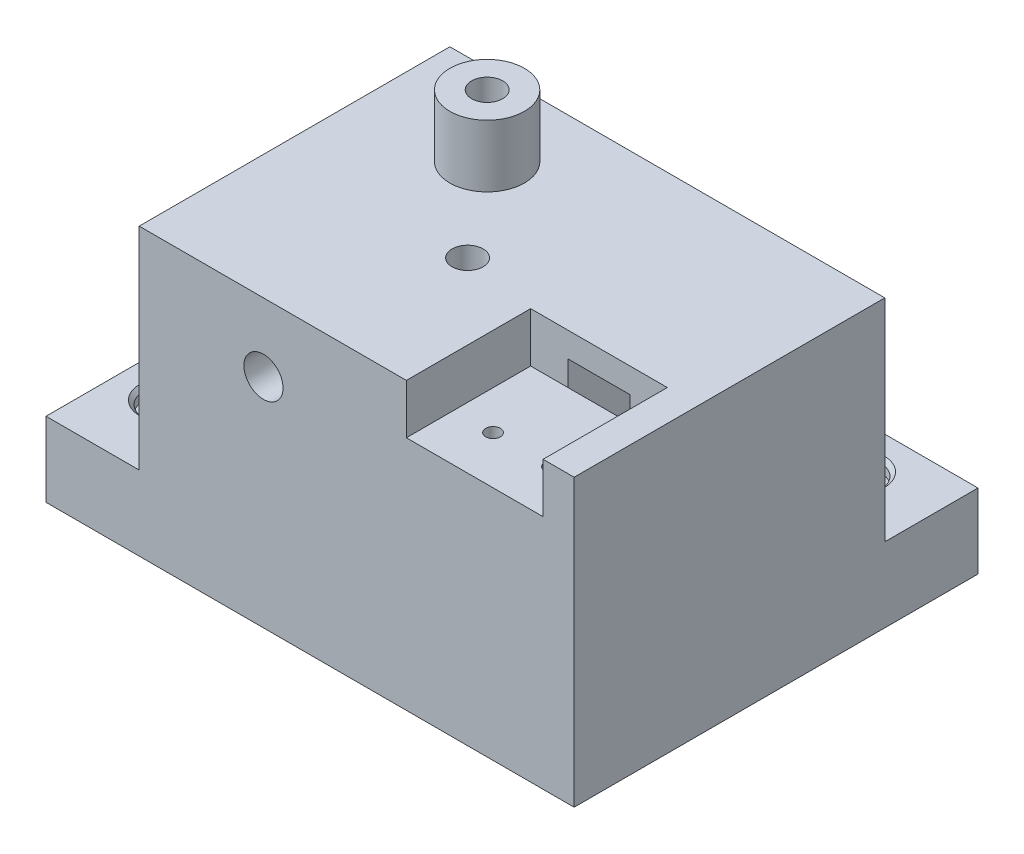
from build123d import *

# Parameters (mm, degrees)
SKETCH1_W                                   = 70
SKETCH1_H                                   = 50
BOSS_EXTRUDE1_DEPTH                         = 46
SKETCH2_R                                   = 3.15
CUT_EXTRUDE1_DEPTH                          = 10
SKETCH3_R                                   = 3.15
CUT_EXTRUDE2_DEPTH                          = 30
SKETCH4_R                                   = 2.5
CUT_EXTRUDE3_DEPTH                          = 10
SKETCH5_W                                   = 50
SKETCH5_H                                   = 12
BOSS_EXTRUDE2_DEPTH                         = 15
SKETCH8_W                                   = 85
SKETCH8_H                                   = 12
BOSS_EXTRUDE5_DEPTH                         = 15
CBORE_FOR_5_BINDING_HEAD_MACHINE_SC_2_COUNT = 2
CBORE_FOR_5_BINDING_HEAD_MACHINE_SC_2_PITCH = 45.5
CBORE_FOR_5_BINDING_HEAD_MACHINE_SC_3_COUNT = 2
CBORE_FOR_5_BINDING_HEAD_MACHINE_SC_3_PITCH = 79.7527429
SKETCH12_R                                  = 3.15
BOSS_EXTRUDE6_DEPTH                         = 10
BOSS_EXTRUDE7_START                         = 10
SKETCH13_R                                  = 6
SKETCH13_R_2                                = 2.5
BOSS_EXTRUDE7_DEPTH                         = 10
SKETCH14_W                                  = 22
SKETCH14_H                                  = 8
CUT_EXTRUDE4_DEPTH                          = 20
SKETCH15_R                                  = 1.185
CUT_EXTRUDE5_DEPTH                          = 10
CUT_EXTRUDE6_DEPTH                          = 10
SKETCH17_W                                  = 10
SKETCH17_H                                  = 10
CUT_EXTRUDE7_DEPTH                          = 63
CUT_EXTRUDE8_DEPTH                          = 2


with BuildPart() as part:
    # Sketch1 → Boss-Extrude1 (new body)
    with BuildSketch(Plane(origin=(0, 0, 0), x_dir=(1, 0, 0), z_dir=(0, 1, 0))):
        with Locations((35, -25)):
            Rectangle(SKETCH1_W, SKETCH1_H)
    extrude(amount=BOSS_EXTRUDE1_DEPTH)

    # Sketch2 → Cut-Extrude1 (cut)
    with BuildSketch(Plane(origin=(70, 0, 0), x_dir=(0, 0, -1), z_dir=(1, 0, 0))):
        with Locations((-25, 35)):
            Circle(SKETCH2_R)
    extrude(amount=-CUT_EXTRUDE1_DEPTH, mode=Mode.SUBTRACT)

    # Sketch3 → Cut-Extrude2 (cut)
    with BuildSketch(Plane.XY.offset(50)):
        with Locations((20, 35)):
            Circle(SKETCH3_R)
    extrude(amount=-CUT_EXTRUDE2_DEPTH, mode=Mode.SUBTRACT)

    # Sketch4 → Cut-Extrude3 (cut)
    with BuildSketch(Plane(origin=(0, 46, 0), x_dir=(1, 0, 0), z_dir=(0, 1, 0))):
        with Locations(Location((30.85, -28, 0), (0, 0, 270))):
            Circle(SKETCH4_R)
        with Locations(Location((19, -13, 0), (0, 0, 270))):
            Circle(SKETCH4_R)
    extrude(amount=-CUT_EXTRUDE3_DEPTH, mode=Mode.SUBTRACT)

    # Sketch5 → Boss-Extrude2 (add)
    with BuildSketch(Plane.ZY):
        with Locations((25, 6)):
            Rectangle(SKETCH5_W, SKETCH5_H)
    extrude(amount=BOSS_EXTRUDE2_DEPTH)

    # Sketch8 → Boss-Extrude5 (add)
    with BuildSketch(Plane(origin=(0, 0, 0), x_dir=(-1, 0, 0), z_dir=(0, 0, -1))):
        with Locations((-27.5, 6)):
            Rectangle(SKETCH8_W, SKETCH8_H)
    extrude(amount=BOSS_EXTRUDE5_DEPTH)

    # Sketch11 → CBORE for #5 Binding Head Machine Screw2 (revolve, cut)
    with BuildSketch(Plane(origin=(-7.5, 12, 38), x_dir=(0, 0, 1), z_dir=(1, 0, 0))):
        Polygon((0, 0), (0, 12), (1.7272, 12), (1.7272, 1.9812), (3.77063, 1.9812), (3.77063, 0.635), (4.40563, 0), align=None)
    cbore_for_5_binding_head_machine_screw2 = revolve(axis=Axis((-7.5, 18.35, 38), (0, -1, 0)), mode=Mode.SUBTRACT)

    # CBORE for _5 Binding Head Machine Sc 2: CBORE for #5 Binding Head Machine Screw2 ×2
    with Locations(*[(0, 0, -i * CBORE_FOR_5_BINDING_HEAD_MACHINE_SC_2_PITCH) for i in range(1, CBORE_FOR_5_BINDING_HEAD_MACHINE_SC_2_COUNT)]):
        add(cbore_for_5_binding_head_machine_screw2, mode=Mode.SUBTRACT)

    # CBORE for _5 Binding Head Machine Sc 3: CBORE for #5 Binding Head Machine Screw2 ×2
    with Locations(*[Vector(0.821288367254118, 0, -0.570513293283395) * (i * CBORE_FOR_5_BINDING_HEAD_MACHINE_SC_3_PITCH) for i in range(1, CBORE_FOR_5_BINDING_HEAD_MACHINE_SC_3_COUNT)]):
        add(cbore_for_5_binding_head_machine_screw2, mode=Mode.SUBTRACT)

    # Sketch12 → Boss-Extrude6 (add)
    with BuildSketch(Plane(origin=(70, 0, 0), x_dir=(0, 0, -1), z_dir=(1, 0, 0))):
        with Locations((-25, 35)):
            Circle(SKETCH12_R)
    extrude(amount=-BOSS_EXTRUDE6_DEPTH)

    # Sketch13 → Boss-Extrude7 (add)
    with BuildSketch(Plane(origin=(0, 46, 0), x_dir=(1, 0, 0), z_dir=(0, 1, 0)).offset(BOSS_EXTRUDE7_START)):
        with Locations(Location((19, -13, 0), (0, 0, 270))):
            Circle(SKETCH13_R)
        with Locations(Location((19, -13, 0), (0, 0, 270))):
            Circle(SKETCH13_R_2, mode=Mode.SUBTRACT)
    extrude(amount=-BOSS_EXTRUDE7_DEPTH)

    # Sketch14 → Cut-Extrude4 (cut)
    with BuildSketch(Plane.XY.offset(50)):
        with Locations((54, 42)):
            Rectangle(SKETCH14_W, SKETCH14_H)
    extrude(amount=-CUT_EXTRUDE4_DEPTH, mode=Mode.SUBTRACT)

    # Sketch15 → Cut-Extrude5 (cut)
    with BuildSketch(Plane(origin=(0, 38, 0), x_dir=(1, 0, 0), z_dir=(0, 1, 0))):
        with Locations(Location((49.25, -42.3, 0), (0, 0, 270))):
            Circle(SKETCH15_R)
        with Locations(Location((58.75, -42.3, 0), (0, 0, 270))):
            Circle(SKETCH15_R)
    extrude(amount=-CUT_EXTRUDE5_DEPTH, mode=Mode.SUBTRACT)

    # Sketch16 → Cut-Extrude6 (cut)
    with BuildSketch(Plane.XY.offset(30)):
        Polygon((54, 42), (59, 42), (59, 38), (49, 38), (49, 42), align=None)
    extrude(amount=-CUT_EXTRUDE6_DEPTH, mode=Mode.SUBTRACT)

    # Sketch17 → Cut-Extrude7 (cut)
    with BuildSketch(Plane(origin=(0, 38, 0), x_dir=(1, 0, 0), z_dir=(0, 1, 0))):
        with Locations((54, -25)):
            Rectangle(SKETCH17_W, SKETCH17_H)
    extrude(amount=-CUT_EXTRUDE7_DEPTH, mode=Mode.SUBTRACT)

    # Sketch18 → Cut-Extrude8 (cut)
    # profile 1 of 2: a face of its own
    with BuildSketch(Plane(origin=(0, 0, 0), x_dir=(-1, 0, 0), z_dir=(0, 0, -1))):
        with BuildLine():
            Line((-67.427489024, 16.704947279), (-67.741591588, 16.704947279))
            add(Edge.make_bspline(
                [(-67.741591588, 16.704947279), (-67.739544435, 16.746618166), (-67.735523881, 16.828458681), (-67.716695592, 16.947782587), (-67.689754714, 17.061837386), (-67.65166326, 17.1697073), (-67.604356983, 17.272346107), (-67.547626955, 17.369346123), (-67.480433105, 17.460337312), (-67.404226371, 17.544476155), (-67.321457732, 17.621663726), (-67.232151792, 17.688318969), (-67.138306765, 17.74463664), (-67.040207366, 17.791717882), (-66.936746802, 17.827057728), (-66.828863944, 17.853279367), (-66.716084808, 17.869055713), (-66.639244786, 17.870751499), (-66.600165306, 17.871613945)],
                knots=[0, 0, 0, 0, 1.10065271, 2.161652631, 3.183658789, 4.190468796, 5.17591951, 6.163126047, 7.15150782, 8.156236427, 9.156009102, 10.134482811, 11.092018607, 12.041330605, 13.001268258, 13.972401359, 14.968799086, 16, 16, 16, 16], degree=3))
            add(Edge.make_bspline(
                [(-66.600165306, 17.871613945), (-66.561787232, 17.870715489), (-66.486375687, 17.868950054), (-66.376313673, 17.853789025), (-66.271536378, 17.830043433), (-66.172248612, 17.796728017), (-66.079242547, 17.75194359), (-65.991819503, 17.698146051), (-65.908938692, 17.635926219), (-65.834331908, 17.562672406), (-65.765823829, 17.484470022), (-65.706721574, 17.400982118), (-65.65610841, 17.314752832), (-65.61392073, 17.225124631), (-65.582864591, 17.131253602), (-65.559286383, 17.034506399), (-65.54595897, 16.933881588), (-65.543913546, 16.865775033), (-65.542873639, 16.831149202)],
                knots=[0, 0, 0, 0, 1.111607364, 2.184268762, 3.212621178, 4.221274766, 5.211760367, 6.196651075, 7.1921475, 8.207485113, 9.220403448, 10.201281604, 11.166441695, 12.114753415, 13.065576456, 14.026450734, 14.996634279, 16, 16, 16, 16], degree=3))
            add(Edge.make_bspline(
                [(-65.542873639, 16.831149202), (-65.544566902, 16.782401367), (-65.547923713, 16.685761154), (-65.57663809, 16.543746291), (-65.621484601, 16.406152872), (-65.675481958, 16.29541557), (-65.729954402, 16.206182076), (-65.77904191, 16.132713371), (-65.836506721, 16.053607903), (-65.903185219, 15.969130565), (-65.977698091, 15.87861966), (-66.060720254, 15.782129865), (-66.152843736, 15.680658095), (-66.217502237, 15.611352493), (-66.251006652, 15.575440067)],
                knots=[0, 0, 0, 0, 1.184426356, 2.348067706, 3.509069118, 4.696110526, 5.333549288, 6.050745305, 6.844228056, 7.710549037, 8.667450064, 9.695053472, 10.805634456, 12, 12, 12, 12], degree=3))
            Line((-66.251006652, 15.575440067), (-67.126707774, 14.640844715))
            Line((-67.126707774, 14.640844715), (-65.498001844, 14.640844715))
            Line((-65.498001844, 14.640844715), (-65.498001844, 14.281870356))
            Line((-65.498001844, 14.281870356), (-67.876206973, 14.281870356))
            Line((-67.876206973, 14.281870356), (-66.518835178, 15.730387984))
            add(Edge.make_bspline(
                [(-66.518835178, 15.730387984), (-66.485787291, 15.76488629), (-66.422309064, 15.831150477), (-66.332526487, 15.927893437), (-66.251887499, 16.017642978), (-66.179870106, 16.100229526), (-66.1180366, 16.176861094), (-66.063164369, 16.245055798), (-66.019198778, 16.307810248), (-65.971483382, 16.380550862), (-65.9252694, 16.469363179), (-65.885557044, 16.577896868), (-65.861342196, 16.689624121), (-65.85843736, 16.765126158), (-65.856976203, 16.80310433)],
                knots=[0, 0, 0, 0, 1.329631726, 2.553950428, 3.673215718, 4.687767853, 5.603093632, 6.413772471, 7.123043292, 7.734684054, 8.834405432, 9.900288307, 10.943827018, 12, 12, 12, 12], degree=3))
            add(Edge.make_bspline(
                [(-65.856976203, 16.80310433), (-65.857611946, 16.826985728), (-65.858864872, 16.874051379), (-65.869922569, 16.943057138), (-65.886633075, 17.009621952), (-65.910578333, 17.073950571), (-65.942185073, 17.135396223), (-65.980658453, 17.194033703), (-66.025048517, 17.250722668), (-66.076399786, 17.303875966), (-66.132811306, 17.352557172), (-66.192405555, 17.395681257), (-66.25545566, 17.431720368), (-66.321695782, 17.461263865), (-66.390941251, 17.484439246), (-66.463325996, 17.500497826), (-66.538650013, 17.51058031), (-66.590083508, 17.511944482), (-66.616291107, 17.512639586)],
                knots=[0, 0, 0, 0, 0.991446411, 1.95395049, 2.89581595, 3.838931463, 4.798493298, 5.75982156, 6.748411868, 7.785213223, 8.824556874, 9.840280684, 10.836137867, 11.835679398, 12.848801643, 13.863922112, 14.911575587, 16, 16, 16, 16], degree=3))
            add(Edge.make_bspline(
                [(-66.616291107, 17.512639586), (-66.64366194, 17.511924554), (-66.697413736, 17.510520349), (-66.776332769, 17.500697685), (-66.851618547, 17.483751844), (-66.92346045, 17.46057517), (-66.991980035, 17.431116621), (-67.056844079, 17.394424877), (-67.117906969, 17.350641383), (-67.175283492, 17.301000827), (-67.228147471, 17.245733226), (-67.274594347, 17.184123263), (-67.315178361, 17.117295847), (-67.350587595, 17.045431297), (-67.379343285, 16.967877517), (-67.401316435, 16.884909812), (-67.418703282, 16.796888431), (-67.424511802, 16.736103346), (-67.427489024, 16.704947279)],
                knots=[0, 0, 0, 0, 1.031018746, 2.02475058, 2.990194455, 3.934040569, 4.864654155, 5.795059489, 6.735614925, 7.690564532, 8.649604399, 9.611025574, 10.590972636, 11.591080095, 12.624614302, 13.701020113, 14.821632451, 16, 16, 16, 16], degree=3))
        make_face()
    # profile 2 of 2: a face of its own
    with BuildSketch(Plane(origin=(0, 0, 0), x_dir=(-1, 0, 0), z_dir=(0, 0, -1))):
        with BuildLine():
            Line((-64.421078767, 14.192126766), (-64.67208037, 14.366706093))
            Line((-64.67208037, 14.366706093), (-63.698923319, 15.789282215))
            add(Edge.make_bspline(
                [(-63.698923319, 15.789282215), (-63.761014054, 15.781689151), (-63.883274174, 15.766737986), (-64.006411276, 15.763991332), (-64.067012261, 15.762639586)],
                knots=[0, 0, 0, 0, 1.015715272, 2, 2, 2, 2], degree=3))
            add(Edge.make_bspline(
                [(-64.067012261, 15.762639586), (-64.103754309, 15.763580663), (-64.175875736, 15.765427914), (-64.281907388, 15.780069722), (-64.383792949, 15.80261985), (-64.481262305, 15.836268605), (-64.57468181, 15.878086814), (-64.663847523, 15.929943827), (-64.748639413, 15.990950119), (-64.828146823, 16.060783111), (-64.900458562, 16.137461163), (-64.96488186, 16.218616806), (-65.018422992, 16.305192777), (-65.062899577, 16.395422996), (-65.096630031, 16.490604347), (-65.121192569, 16.589653747), (-65.136314923, 16.693265389), (-65.138114018, 16.76379052), (-65.139027485, 16.799598721)],
                knots=[0, 0, 0, 0, 1.060718605, 2.082097864, 3.085795603, 4.069760067, 5.054557537, 6.03741023, 7.043284206, 8.066802108, 9.088538119, 10.083643548, 11.053783639, 12.022749082, 12.983451788, 13.964007469, 14.966251758, 16, 16, 16, 16], degree=3))
            add(Edge.make_bspline(
                [(-65.139027485, 16.799598721), (-65.137293051, 16.848567374), (-65.133888707, 16.944682905), (-65.10649019, 17.085116674), (-65.06142985, 17.217903218), (-64.998601474, 17.342693412), (-64.919466752, 17.457692151), (-64.824358162, 17.56130076), (-64.713854198, 17.652045614), (-64.590472179, 17.730049691), (-64.457119158, 17.792784689), (-64.3174505, 17.839023989), (-64.17253638, 17.866222737), (-64.07436871, 17.869808598), (-64.024944953, 17.871613945)],
                knots=[0, 0, 0, 0, 1.022988612, 2.007919123, 2.978103895, 3.94594894, 4.918897164, 5.887013414, 6.875921846, 7.89917871, 8.930658928, 9.948724884, 10.967259574, 12, 12, 12, 12], degree=3))
            add(Edge.make_bspline(
                [(-64.024944953, 17.871613945), (-63.976456534, 17.869783782), (-63.880647987, 17.866167553), (-63.73975898, 17.839683584), (-63.604817963, 17.795046911), (-63.476572977, 17.733362347), (-63.357833564, 17.656041439), (-63.251057753, 17.563906916), (-63.158682214, 17.456901388), (-63.080858333, 17.337612898), (-63.018388293, 17.209445917), (-62.97331601, 17.075661995), (-62.945570371, 16.937223273), (-62.942074044, 16.843428799), (-62.940309537, 16.796093112)],
                knots=[0, 0, 0, 0, 1.026385292, 2.028040595, 3.023318987, 4.028184125, 5.03290303, 6.015178782, 7.004435299, 8.016004309, 9.023023918, 10.015172535, 10.998308025, 12, 12, 12, 12], degree=3))
            add(Edge.make_bspline(
                [(-62.940309537, 16.796093112), (-62.941487946, 16.759349345), (-62.943878053, 16.684823804), (-62.96061436, 16.571593461), (-62.989034546, 16.456142232), (-63.021286244, 16.358420636), (-63.052418412, 16.277712186), (-63.081719544, 16.213960606), (-63.114231697, 16.146859343), (-63.152150463, 16.077112005), (-63.192912759, 16.00382947), (-63.238972036, 15.927746754), (-63.289277608, 15.848761761), (-63.325107327, 15.795514673), (-63.343454569, 15.768248561)],
                knots=[0, 0, 0, 0, 1.179839688, 2.393009684, 3.667231171, 4.993948276, 5.694988576, 6.444077775, 7.246288328, 8.089075292, 8.993003841, 9.939041771, 10.944649915, 12, 12, 12, 12], degree=3))
            Line((-63.343454569, 15.768248561), (-64.421078767, 14.192126766))
        make_face()
        with BuildLine():
            add(Edge.make_bspline(
                [(-64.008819152, 16.121613945), (-63.980985138, 16.122374329), (-63.926801775, 16.123854538), (-63.847424476, 16.13286378), (-63.772500272, 16.148837766), (-63.701829023, 16.171757478), (-63.634702121, 16.199414147), (-63.572185793, 16.234626133), (-63.514227718, 16.276642768), (-63.460439791, 16.323852783), (-63.412675791, 16.376303367), (-63.37013276, 16.431200474), (-63.333972193, 16.488785084), (-63.305408916, 16.549778346), (-63.28192434, 16.612695554), (-63.265706328, 16.67854991), (-63.256721995, 16.74699831), (-63.25519042, 16.793496968), (-63.254412101, 16.817126766)],
                knots=[0, 0, 0, 0, 1.163407946, 2.26475976, 3.333800367, 4.359385343, 5.366239384, 6.363380779, 7.350133999, 8.353570782, 9.349036268, 10.310270964, 11.253520213, 12.184142, 13.120487599, 14.056272588, 15.012232024, 16, 16, 16, 16], degree=3))
            add(Edge.make_bspline(
                [(-63.254412101, 16.817126766), (-63.25508177, 16.840766431), (-63.256401435, 16.887351291), (-63.266988735, 16.955901031), (-63.285613958, 17.021594292), (-63.310604443, 17.084790722), (-63.343524681, 17.144971094), (-63.383028166, 17.202890965), (-63.429960616, 17.258183093), (-63.483963182, 17.309547077), (-63.542197735, 17.356894976), (-63.604258235, 17.398681052), (-63.669633151, 17.433702248), (-63.737923641, 17.462601218), (-63.80927199, 17.485152994), (-63.883635978, 17.501370359), (-63.961391384, 17.510342113), (-64.01417267, 17.511864008), (-64.041070755, 17.512639586)],
                knots=[0, 0, 0, 0, 0.972161553, 1.915763587, 2.844109794, 3.775983486, 4.705125789, 5.659731448, 6.655561913, 7.682237399, 8.721216875, 9.739758359, 10.754845918, 11.767244016, 12.7857855, 13.828538656, 14.893392813, 16, 16, 16, 16], degree=3))
            add(Edge.make_bspline(
                [(-64.041070755, 17.512639586), (-64.067734908, 17.511862755), (-64.120049757, 17.510338617), (-64.197113917, 17.501387412), (-64.270975085, 17.485043928), (-64.342116705, 17.462611664), (-64.410405165, 17.433700093), (-64.475776998, 17.398679217), (-64.537852015, 17.356904595), (-64.596030736, 17.309509822), (-64.650128658, 17.258422176), (-64.696254187, 17.202648747), (-64.735848079, 17.145001223), (-64.768723082, 17.084782715), (-64.793725599, 17.021596429), (-64.8123476, 16.955900452), (-64.822935766, 16.887351442), (-64.824255312, 16.840766482), (-64.824924921, 16.817126766)],
                knots=[0, 0, 0, 0, 1.099389452, 2.15699305, 3.192601482, 4.213358962, 5.227959689, 6.245255729, 7.266013209, 8.307253147, 9.336162325, 10.327954924, 11.284637477, 12.215801273, 13.149702402, 14.080068371, 15.025723358, 16, 16, 16, 16], degree=3))
            add(Edge.make_bspline(
                [(-64.824924921, 16.817126766), (-64.824318995, 16.793478567), (-64.823123998, 16.746839991), (-64.811596208, 16.678313598), (-64.792317928, 16.612625404), (-64.766498538, 16.549136697), (-64.732496948, 16.488464839), (-64.6907731, 16.430897477), (-64.641867554, 16.375782027), (-64.586434066, 16.323974815), (-64.525765905, 16.276422639), (-64.460969159, 16.234892257), (-64.393159322, 16.199819813), (-64.322097691, 16.171678429), (-64.248310891, 16.149066766), (-64.17113576, 16.13289322), (-64.090827523, 16.123940954), (-64.036417541, 16.122397057), (-64.008819152, 16.121613945)],
                knots=[0, 0, 0, 0, 0.952633368, 1.87876736, 2.791047057, 3.707742249, 4.635551637, 5.587206343, 6.568248508, 7.601284464, 8.641511608, 9.671105535, 10.699146789, 11.713763218, 12.747829548, 13.806491675, 14.887386225, 16, 16, 16, 16], degree=3))
        make_face(mode=Mode.SUBTRACT)
    extrude(amount=-CUT_EXTRUDE8_DEPTH, mode=Mode.SUBTRACT)


solid = part.part
